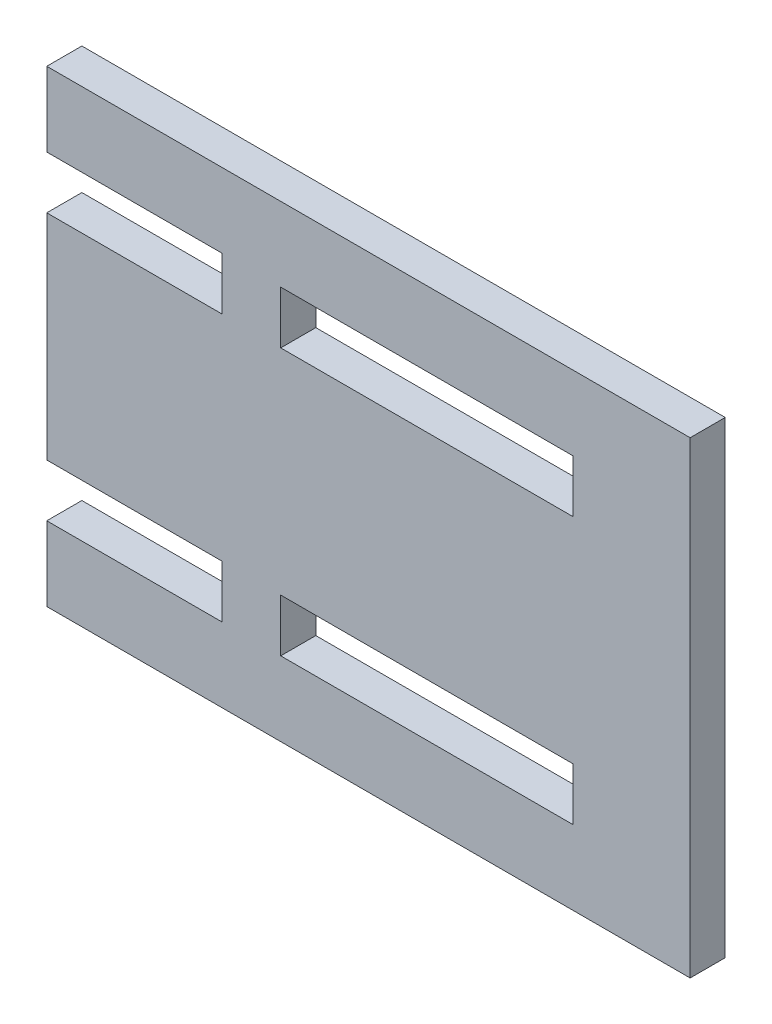
from build123d import *

# Parameters (mm, degrees)
SKETCH1_W           = 25
SKETCH1_H           = 4.5
BOSS_EXTRUDE1_DEPTH = 3


with BuildPart() as part:
    # Sketch1 → Boss-Extrude1 (new body)
    with BuildSketch(Plane.XY):
        Polygon((-33.65, -10.85), (21.35, -10.85), (21.35, 29.15), (-33.65, 29.15), (-33.65, 22.8), (-18.65, 22.8), (-18.65, 18.3), (-33.65, 18.3), (-33.65, 0), (-18.65, 0), (-18.65, -4.5), (-33.65, -4.5), align=None)
        with Locations((-1.15, -2.25)):
            Rectangle(SKETCH1_W, SKETCH1_H, mode=Mode.SUBTRACT)
        with Locations((-1.15, 20.55)):
            Rectangle(SKETCH1_W, SKETCH1_H, mode=Mode.SUBTRACT)
    extrude(amount=-BOSS_EXTRUDE1_DEPTH)


solid = part.part
